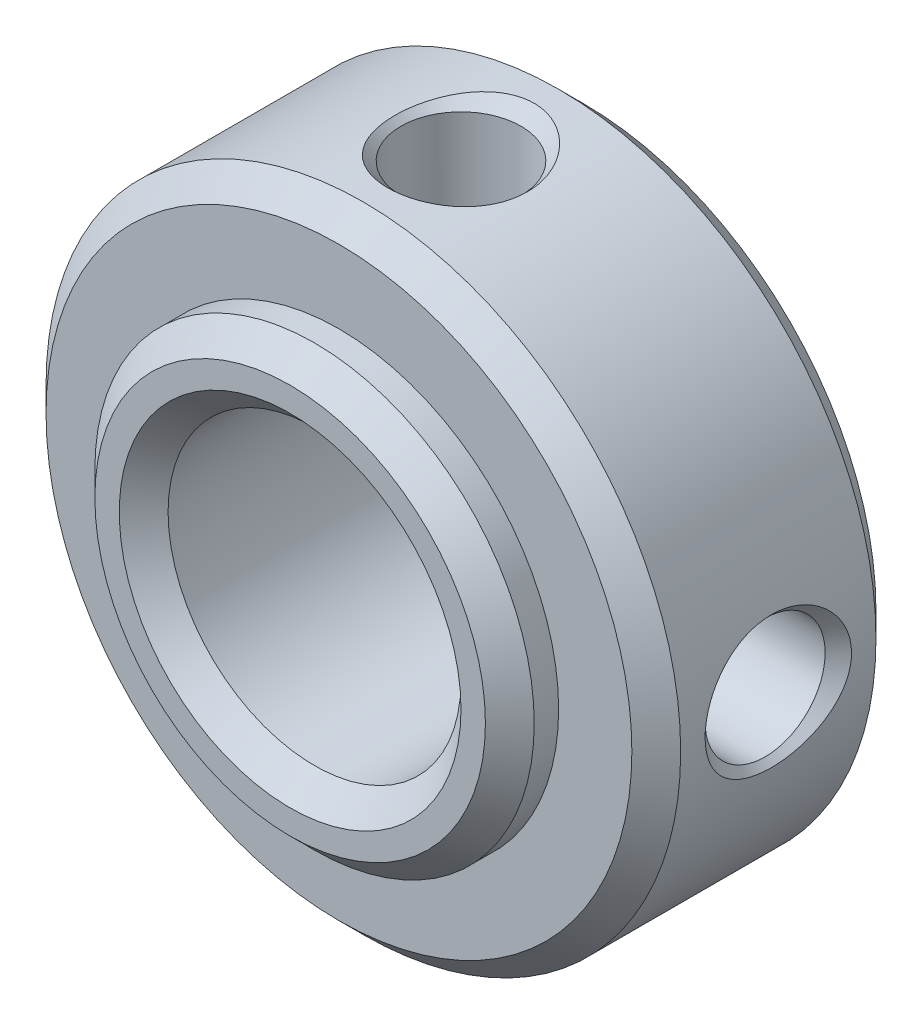
from build123d import *


with BuildPart() as part:
    # Esquisse1 → Révolution1 (revolve)
    with BuildSketch(Plane(origin=(0, 0, 0), x_dir=(1, 0, 0), z_dir=(0, 1, 0))):
        Polygon((3, 2), (3, -3), (3.5, -3.5), (4, -3.5), (4.5, -3), (4.5, -2.5), (6, -2.5), (6.5, -2), (6.5, 2), (6, 2.5), (3.5, 2.5), align=None)
    revolve(axis=Axis((0, 0, 3.5), (0, 0, -1)))

    # Esquisse2 → Enlèvement de matière-Révolution1 (revolve, cut)
    with BuildSketch(Plane.XY, mode=Mode.PRIVATE) as enl_vement_de_mati_re_r_volution1_sk:
        Polygon((2, 0), (2, 1.2295), (6.2295, 1.2295), (6.5, 1.5), (6.5, 0), align=None)
    revolve(enl_vement_de_mati_re_r_volution1_sk.sketch.rotate(Axis((6.5, 0, 0), (-1, 0, 0)), 90), axis=Axis((6.5, 0, 0), (-1, 0, 0)), mode=Mode.SUBTRACT)

    # Esquisse3 → Enlèvement de matière-Révolution2 (revolve, cut)
    with BuildSketch(Plane.XY):
        Polygon((0, 2), (-1.2295, 2), (-1.2295, 6.2295), (-1.5, 6.5), (0, 6.5), align=None)
    revolve(axis=Axis((0, 6.5, 0), (0, -1, 0)), mode=Mode.SUBTRACT)


solid = part.part
